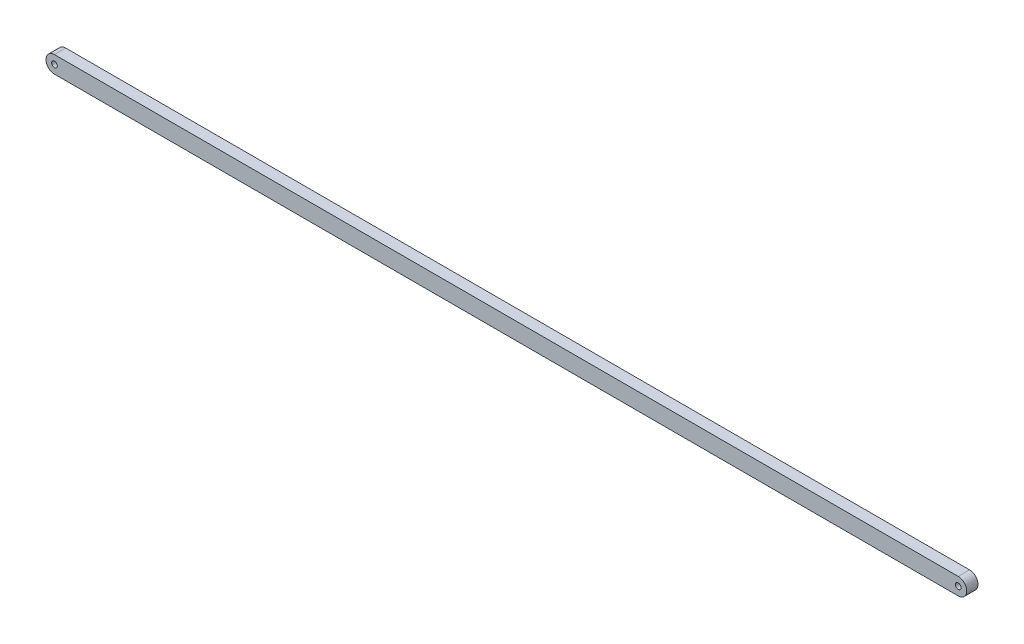
from build123d import *

# Parameters (mm, degrees)
EXTRUDE_1_DEPTH     = 2
SKETCH_2_R          = 0.5
CUT_EXTRUDE_1_DEPTH = 2


with BuildPart() as part:
    # 草图1 → 凸台-拉伸1 (new body)
    with BuildSketch(Plane.XY):
        with BuildLine():
            Line((0, 1.5), (160, 1.5))
            ThreePointArc((160, 1.5), (161.5, 0), (160, -1.5))
            Line((160, -1.5), (0, -1.5))
            ThreePointArc((0, -1.5), (-1.5, 0), (0, 1.5))
        make_face()
    extrude(amount=EXTRUDE_1_DEPTH)

    # 草图2 → 切除-拉伸1 (cut)
    with BuildSketch(Plane(origin=(0, 0, 0), x_dir=(-1, 0, 0), z_dir=(0, 0, -1))):
        with Locations((-160, 0)):
            Circle(SKETCH_2_R)
        Circle(SKETCH_2_R)
    extrude(amount=-CUT_EXTRUDE_1_DEPTH, mode=Mode.SUBTRACT)


solid = part.part
